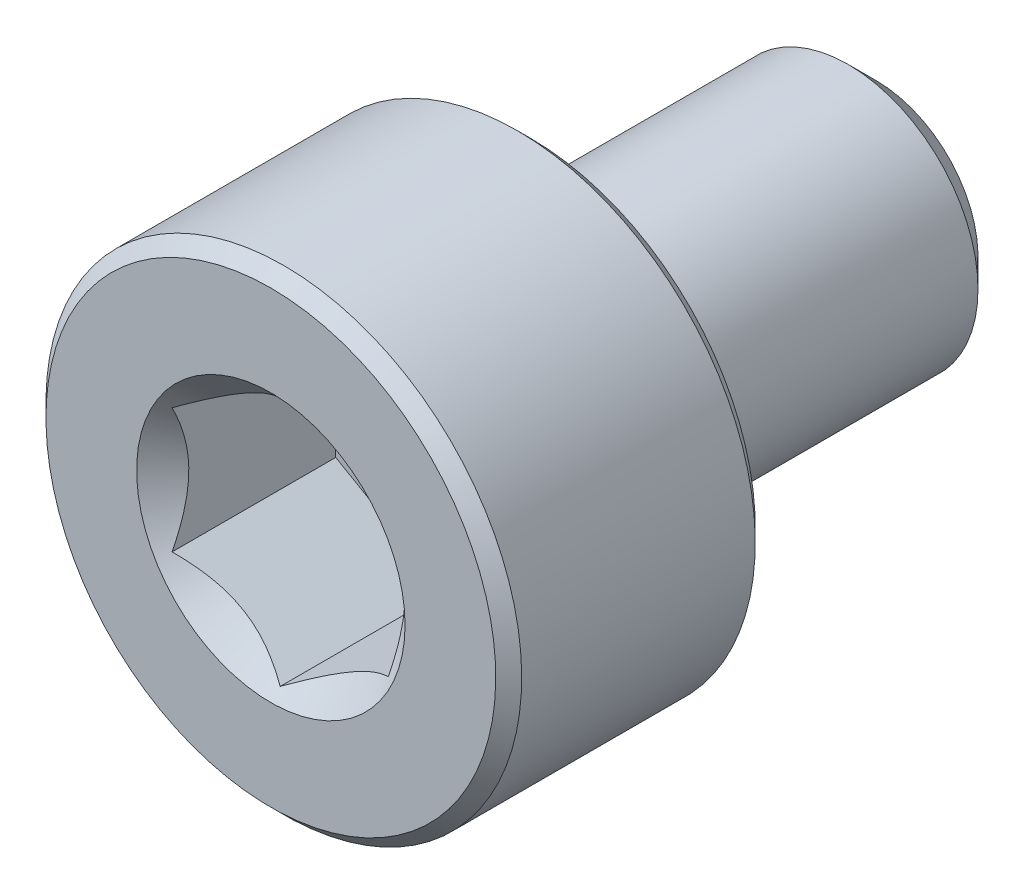
from build123d import *

# Parameters (mm, degrees)
CUT_EXTRUDE1_DEPTH = 2
SKETCH4_R          = 1.551628848
CUT_EXTRUDE2_DEPTH = 1.5
CUT_EXTRUDE2_DRAFT = -45


with BuildPart() as part:
    # Sketch2 → Revolve1 (revolve)
    with BuildSketch(Plane(origin=(0, 0, 0), x_dir=(0, 0, -1), z_dir=(1, 0, 0))):
        with BuildLine():
            Line((-3.5, 0), (-3.5, 2.6))
            Line((-3.5, 2.6), (-3.35, 2.75))
            Line((-3.35, 2.75), (-0.65, 2.75))
            Line((-0.65, 2.75), (-0.5, 2.6))
            Line((-0.5, 2.6), (-0.5, 1.65))
            ThreePointArc((-0.5, 1.65), (-0.456066017, 1.543933983), (-0.35, 1.5))
            Line((-0.35, 1.5), (3.175240474, 1.5))
            Line((3.175240474, 1.5), (3.5, 1.175240474))
            Line((3.5, 1.175240474), (3.5, 0))
            Line((3.5, 0), (-3.5, 0))
        make_face()
    revolve(axis=Axis((0, 0, -3.5), (0, 0, 1)))

    # Sketch3 → Cut-Extrude1 (cut)
    with BuildSketch(Plane.XY.offset(3.5)):
        Polygon((1.25, -0.721687836), (1.25, 0.721687836), (0, 1.443375673), (-1.25, 0.721687836), (-1.25, -0.721687836), (0, -1.443375673), align=None)
    extrude(amount=-CUT_EXTRUDE1_DEPTH, mode=Mode.SUBTRACT)


with BuildPart() as cut_extrude2_tool:
    # Sketch4 → Cut-Extrude2 (with draft: the straight prism first)
    with BuildSketch(Plane.XY.offset(3.5)):
        Circle(SKETCH4_R)
    extrude(amount=-CUT_EXTRUDE2_DEPTH)
    # Cut-Extrude2: the draft: its side faces are tilted about the plane it starts from
    cut_extrude2_sides = [cut_extrude2_tool.faces().sort_by_distance(p)[0] for p in [
        (-1.551628848, 0, 2.75),
    ]]
    draft(cut_extrude2_sides, Plane.XY.offset(3.5), CUT_EXTRUDE2_DRAFT)


with BuildPart() as part_1:
    add(part.part)

    # Cut-Extrude2: cut by cut_extrude2_tool
    add(cut_extrude2_tool.part, mode=Mode.SUBTRACT)


solid = part_1.part
